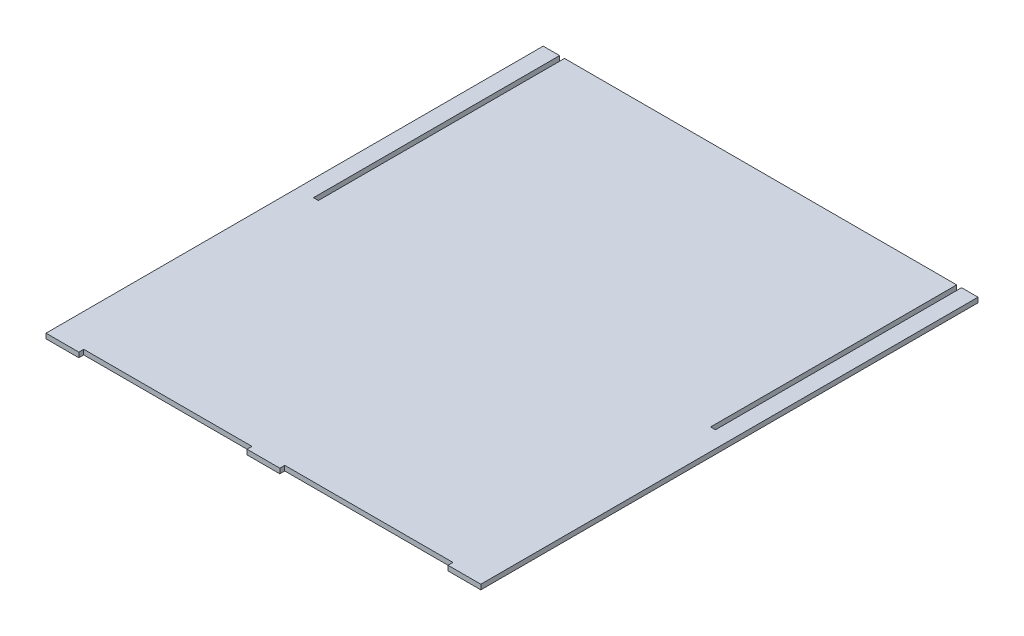
from build123d import *

# Parameters (mm, degrees)
BOSS_EXTRUDE1_DEPTH = 6
SKETCH2_W           = 6
SKETCH2_H           = 300
CUT_EXTRUDE1_DEPTH  = 6
LPATTERN1_COUNT     = 2
LPATTERN1_PITCH     = 484


with BuildPart() as part:
    # Sketch1 → Boss-Extrude1 (new body)
    with BuildSketch(Plane(origin=(0, 0, 0), x_dir=(1, 0, 0), z_dir=(0, 1, 0))):
        Polygon((-530, 0), (-490, 0), (-490, 6), (-285, 6), (-285, 0), (-245, 0), (-245, 6), (-40, 6), (-40, 0), (0, 0), (0, 606), (-530, 606), align=None)
    extrude(amount=BOSS_EXTRUDE1_DEPTH)

    # Sketch2 → Cut-Extrude1 (cut)
    with BuildSketch(Plane(origin=(0, 6, 0), x_dir=(1, 0, 0), z_dir=(0, 1, 0))):
        with Locations((-23, 456)):
            Rectangle(SKETCH2_W, SKETCH2_H)
    cut_extrude1 = extrude(amount=-CUT_EXTRUDE1_DEPTH, mode=Mode.SUBTRACT)

    # LPattern1: Cut-Extrude1 ×2
    with Locations(*[(-i * LPATTERN1_PITCH, 0, 0) for i in range(1, LPATTERN1_COUNT)]):
        add(cut_extrude1, mode=Mode.SUBTRACT)


solid = part.part
